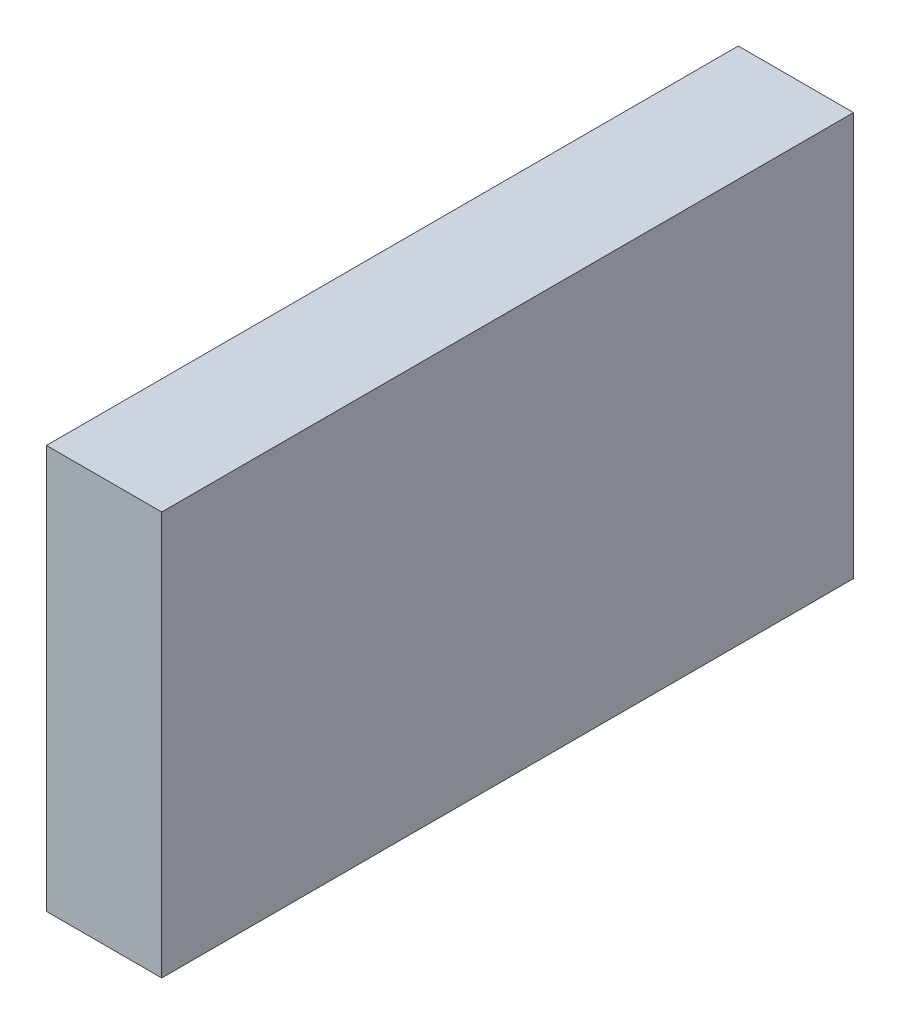
from build123d import *

# Parameters (mm, degrees)
SKETCH1_W           = 50.8
SKETCH1_H           = 177.8
BOSS_EXTRUDE1_DEPTH = 304.8


with BuildPart() as part:
    # Sketch1 → Boss-Extrude1 (new body)
    with BuildSketch(Plane.XY):
        Rectangle(SKETCH1_W, SKETCH1_H)
    extrude(amount=BOSS_EXTRUDE1_DEPTH)


solid = part.part
